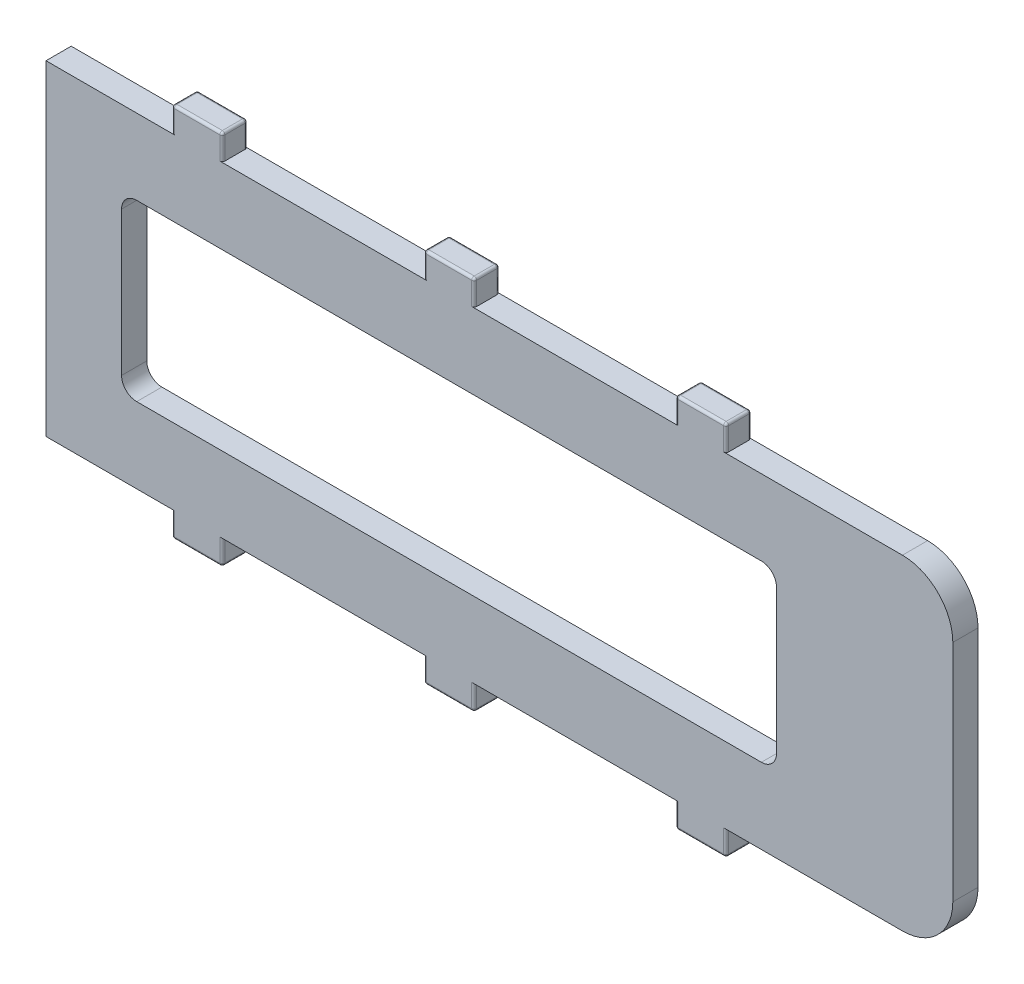
from build123d import *

# Parameters (mm, degrees)
CROQUIS1_W               = 180
CROQUIS1_H               = 64.6
SALIENTE_EXTRUIR1_DEPTH  = 5
CROQUIS2_W               = 10
CROQUIS2_H               = 5
SALIENTE_EXTRUIR2_DEPTH  = 5
REDONDEO1_R              = 0.5
REDONDEO1_OF_SIMETR_A1_R = 0.5
REDONDEO2_R              = 10
CROQUIS3_W               = 130
CROQUIS3_H               = 34.6
CORTAR_EXTRUIR1_DEPTH    = 5
REDONDEO3_R              = 3


with BuildPart() as part:
    # Croquis1 → Saliente-Extruir1 (new body)
    with BuildSketch(Plane.XY):
        Rectangle(CROQUIS1_W, CROQUIS1_H)
    extrude(amount=SALIENTE_EXTRUIR1_DEPTH)

    # Croquis2 → Saliente-Extruir2 (add)
    with BuildSketch(Plane(origin=(0, 32.3, 0), x_dir=(1, 0, 0), z_dir=(0, 1, 0))):
        with Locations((-60, -2.5)):
            Rectangle(CROQUIS2_W, CROQUIS2_H)
        with Locations((-10, -2.5)):
            Rectangle(CROQUIS2_W, CROQUIS2_H)
        with Locations((40, -2.5)):
            Rectangle(CROQUIS2_W, CROQUIS2_H)
    saliente_extruir2 = extrude(amount=SALIENTE_EXTRUIR2_DEPTH)

    # Redondeo1
    redondeo1_edges = [part.edges().sort_by_distance(p)[0] for p in [
        (-65, 34.8, 0),
        (-65, 34.8, 5),
        (-55, 34.8, 5),
        (-55, 34.8, 0),
        (-65, 37.3, 2.5),
        (-60, 37.3, 5),
        (-55, 37.3, 2.5),
        (-60, 37.3, 0),
        (-15, 34.8, 0),
        (-15, 34.8, 5),
        (-5, 34.8, 5),
        (-5, 34.8, 0),
        (-15, 37.3, 2.5),
        (-10, 37.3, 5),
        (-5, 37.3, 2.5),
        (-10, 37.3, 0),
        (35, 34.8, 0),
        (35, 34.8, 5),
        (45, 34.8, 5),
        (45, 34.8, 0),
        (35, 37.3, 2.5),
        (40, 37.3, 5),
        (45, 37.3, 2.5),
        (40, 37.3, 0),
    ]]
    fillet(redondeo1_edges, radius=REDONDEO1_R)

    # Simetría1: Saliente-Extruir2 across plane
    add(saliente_extruir2.mirror(Plane.ZX))

    # Redondeo1 of Simetría1
    redondeo1_of_simetr_a1_edges = [part.edges().sort_by_distance(p)[0] for p in [
        (-65, -34.8, 0),
        (-65, -34.8, 5),
        (-55, -34.8, 5),
        (-55, -34.8, 0),
        (-65, -37.3, 2.5),
        (-60, -37.3, 5),
        (-55, -37.3, 2.5),
        (-60, -37.3, 0),
        (-15, -34.8, 0),
        (-15, -34.8, 5),
        (-5, -34.8, 5),
        (-5, -34.8, 0),
        (-15, -37.3, 2.5),
        (-10, -37.3, 5),
        (-5, -37.3, 2.5),
        (-10, -37.3, 0),
        (35, -34.8, 0),
        (35, -34.8, 5),
        (45, -34.8, 5),
        (45, -34.8, 0),
        (35, -37.3, 2.5),
        (40, -37.3, 5),
        (45, -37.3, 2.5),
        (40, -37.3, 0),
    ]]
    fillet(redondeo1_of_simetr_a1_edges, radius=REDONDEO1_OF_SIMETR_A1_R)

    # Redondeo2
    redondeo2_edges = [part.edges().sort_by_distance(p)[0] for p in [
        (90, 32.3, 2.5),
        (90, -32.3, 2.5),
    ]]
    fillet(redondeo2_edges, radius=REDONDEO2_R)

    # Croquis3 → Cortar-Extruir1 (cut)
    with BuildSketch(Plane(origin=(0, 0, 0), x_dir=(-1, 0, 0), z_dir=(0, 0, -1))):
        with Locations((10, 0)):
            Rectangle(CROQUIS3_W, CROQUIS3_H)
    extrude(amount=-CORTAR_EXTRUIR1_DEPTH, mode=Mode.SUBTRACT)

    # Redondeo3
    redondeo3_edges = [part.edges().sort_by_distance(p)[0] for p in [
        (55, -17.3, 2.5),
        (55, 17.3, 2.5),
        (-75, 17.3, 2.5),
        (-75, -17.3, 2.5),
    ]]
    fillet(redondeo3_edges, radius=REDONDEO3_R)


solid = part.part
